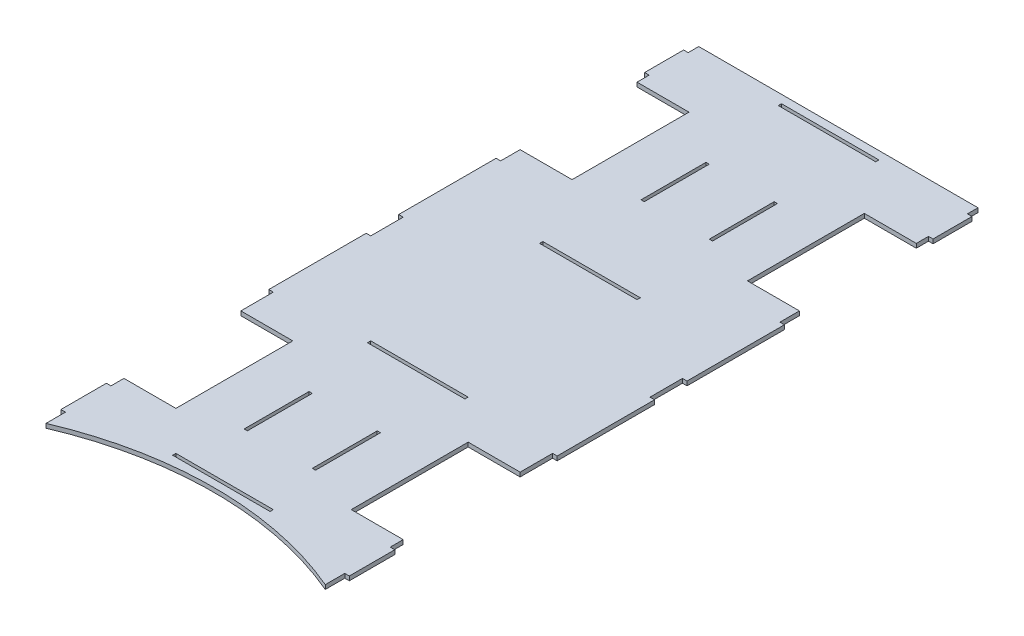
from build123d import *

# Parameters (mm, degrees)
BOSS_EXTRUDE1_DEPTH = 1.3
SKETCH2_W           = 1.4
SKETCH2_H           = 12
SKETCH2_H_2         = 30
SKETCH2_H_3         = 14
BOSS_EXTRUDE2_DEPTH = 1.3
SKETCH3_W           = 30
SKETCH3_H           = 1
CUT_EXTRUDE1_DEPTH  = 110.421433001
SKETCH4_W           = 30
SKETCH4_H           = 1
CUT_EXTRUDE2_DEPTH  = 110.421433001
SKETCH6_W           = 30
SKETCH6_H           = 1
CUT_EXTRUDE3_DEPTH  = 110.421433001
SKETCH7_W           = 1
SKETCH7_H           = 20
SKETCH7_W_2         = 30
SKETCH7_H_2         = 1
CUT_EXTRUDE4_DEPTH  = 110.421433001
SKETCH8_W           = 1
SKETCH8_H           = 20
CUT_EXTRUDE5_DEPTH  = 110.421433001
SKETCH9_W           = 86
SKETCH9_H           = 1
BOSS_EXTRUDE3_DEPTH = 1.3


with BuildPart() as part:
    # Sketch1 → Boss-Extrude1 (new body)
    with BuildSketch(Plane(origin=(0, 0, 0), x_dir=(1, 0, 0), z_dir=(0, 1, 0))):
        with BuildLine():
            Line((43, 100), (-43, 100))
            Line((-43, 100), (-43, 82))
            Line((-43, 82), (-27, 82))
            Line((-27, 82), (-27, 46))
            Line((-27, 46), (-43, 46))
            Line((-43, 46), (-43, -40))
            Line((-43, -40), (-27, -40))
            Line((-27, -40), (-27, -76))
            Line((-27, -76), (-43, -76))
            Line((-43, -76), (-43, -100))
            ThreePointArc((-43, -100), (0, -91.240962318), (43, -100))
            Line((43, -100), (43, -76))
            Line((43, -76), (27, -76))
            Line((27, -76), (27, -40))
            Line((27, -40), (43, -40))
            Line((43, -40), (43, 46))
            Line((43, 46), (27, 46))
            Line((27, 46), (27, 82))
            Line((27, 82), (43, 82))
            Line((43, 82), (43, 100))
        make_face()
    extrude(amount=BOSS_EXTRUDE1_DEPTH)

    # Sketch2 → Boss-Extrude2 (add)
    with BuildSketch(Plane(origin=(0, 0, 0), x_dir=(1, 0, 0), z_dir=(0, 1, 0))):
        with Locations((43.7, 91.75)):
            Rectangle(SKETCH2_W, SKETCH2_H)
        with Locations((43.7, 25)):
            Rectangle(SKETCH2_W, SKETCH2_H_2)
        with Locations((43.7, -87)):
            Rectangle(SKETCH2_W, SKETCH2_H_3)
        with Locations((43.7, -15)):
            Rectangle(SKETCH2_W, SKETCH2_H_2)
    boss_extrude2 = extrude(amount=BOSS_EXTRUDE2_DEPTH)

    # Mirror1: Boss-Extrude2 across plane
    add(boss_extrude2.mirror(Plane(origin=(0, 0, 0), x_dir=(0, 0, 1), z_dir=(1, 0, 0))))

    # Sketch3 → Cut-Extrude1 (cut, through all)
    with BuildSketch(Plane(origin=(0, 1.3, 0), x_dir=(1, 0, 0), z_dir=(0, 1, 0))):
        with Locations((0, 98)):
            Rectangle(SKETCH3_W, SKETCH3_H)
    extrude(amount=-CUT_EXTRUDE1_DEPTH, mode=Mode.SUBTRACT)

    # Sketch4 → Cut-Extrude2 (cut, through all)
    with BuildSketch(Plane(origin=(0, 1.3, 0), x_dir=(1, 0, 0), z_dir=(0, 1, 0))):
        with Locations((0, -88.5)):
            Rectangle(SKETCH4_W, SKETCH4_H)
    extrude(amount=-CUT_EXTRUDE2_DEPTH, mode=Mode.SUBTRACT)

    # Sketch6 → Cut-Extrude3 (cut, through all)
    with BuildSketch(Plane(origin=(0, 1.3, 0), x_dir=(1, 0, 0), z_dir=(0, 1, 0))):
        with Locations((0, 24.5)):
            Rectangle(SKETCH6_W, SKETCH6_H)
    extrude(amount=-CUT_EXTRUDE3_DEPTH, mode=Mode.SUBTRACT)

    # Sketch7 → Cut-Extrude4 (cut, through all)
    with BuildSketch(Plane(origin=(0, 1.3, 0), x_dir=(1, 0, 0), z_dir=(0, 1, 0))):
        with Locations((-10.5, -61)):
            Rectangle(SKETCH7_W, SKETCH7_H)
        with Locations((10.5, -61)):
            Rectangle(SKETCH7_W, SKETCH7_H)
        with Locations((0, -28.5)):
            Rectangle(SKETCH7_W_2, SKETCH7_H_2)
    extrude(amount=-CUT_EXTRUDE4_DEPTH, mode=Mode.SUBTRACT)

    # Sketch8 → Cut-Extrude5 (cut, through all)
    with BuildSketch(Plane(origin=(0, 1.3, 0), x_dir=(1, 0, 0), z_dir=(0, 1, 0))):
        with Locations((-10.5, 61.25)):
            Rectangle(SKETCH8_W, SKETCH8_H)
        with Locations((10.5, 61.25)):
            Rectangle(SKETCH8_W, SKETCH8_H)
    extrude(amount=-CUT_EXTRUDE5_DEPTH, mode=Mode.SUBTRACT)

    # Sketch9 → Boss-Extrude3 (add)
    with BuildSketch(Plane(origin=(0, 0, 0), x_dir=(1, 0, 0), z_dir=(0, 1, 0))):
        with Locations((0, 100.5)):
            Rectangle(SKETCH9_W, SKETCH9_H)
    extrude(amount=BOSS_EXTRUDE3_DEPTH)


solid = part.part
